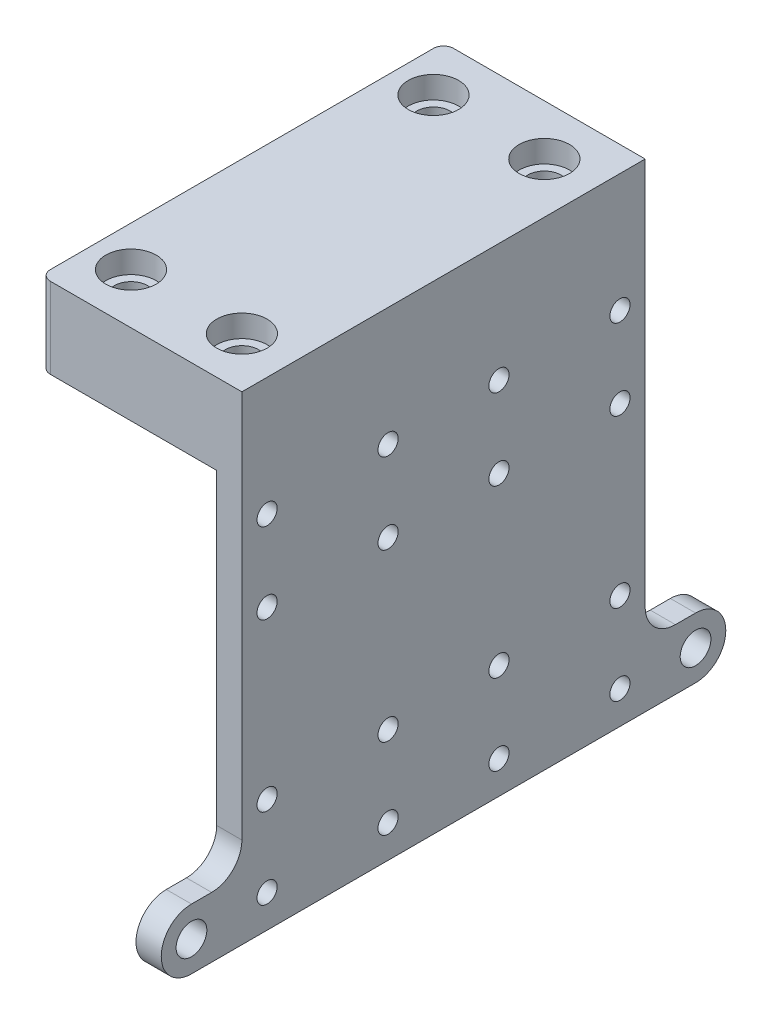
from build123d import *

# Parameters (mm, degrees)
EXTRUDE_1_DEPTH     = 20
RIB_1_REACH         = 57.283
SKETCH_2_WALL_W     = 155.769731092
SKETCH_2_WALL_H     = 4
HOLE_WIZARD_M4_1_D  = 3.3
SKETCH_6_R          = 2.5
CUT_EXTRUDE_1_DEPTH = 2.2
SKETCH_7_R          = 1
CUT_EXTRUDE_2_DEPTH = 10
FILLET_1_R          = 1
SKETCH_8_R          = 1.525
EXTRUDE_2_DEPTH     = 2.5
FILLET_2_R          = 3


with BuildPart() as part:
    # 草图1 → 凸台-拉伸1 (new, symmetric)
    with BuildSketch(Plane.XY):
        Polygon((0, 0), (20, 0), (20, -47.5), (17.5, -47.5), (17.5, -8), (0, -8), align=None)
    extrude(amount=EXTRUDE_1_DEPTH, both=True)

    # 草图2 wall → 筋1 (add, up to next)
    with BuildSketch(Plane(origin=(8.75, -27.75, 0), x_dir=(0.405064377285, -0.914288165872, 0), z_dir=(0.914288165872, 0.405064377285, 0)), mode=Mode.PRIVATE) as rib_1_sk1:
        Rectangle(SKETCH_2_WALL_W, SKETCH_2_WALL_H)
    rib_1_tool1 = extrude(rib_1_sk1.sketch, amount=RIB_1_REACH, mode=Mode.PRIVATE) - part.part
    add(rib_1_tool1.solids().sort_by_distance((8.75, -27.75, 0))[0])

    # M4 螺纹孔1 (through all)
    with Locations(Plane(origin=(0, -8, 0), x_dir=(-1, 0, 0), z_dir=(0, -1, 0))):
        with Locations((-4, 15), (-15, 15)):
            hole_wizard_m4_1 = Hole(HOLE_WIZARD_M4_1_D / 2)

    # 镜向1: M4 螺纹孔1 across plane
    add(hole_wizard_m4_1.mirror(Plane.XY), mode=Mode.SUBTRACT)

    # 草图6 → 切除-拉伸1 (cut)
    with BuildSketch(Plane(origin=(0, 0, 0), x_dir=(1, 0, 0), z_dir=(0, 1, 0))):
        with Locations(Location((15, 15, 0), (0, 0, 270))):
            Circle(SKETCH_6_R)
        with Locations(Location((4, 15, 0), (0, 0, 270))):
            Circle(SKETCH_6_R)
        with Locations(Location((4, -15, 0), (0, 0, 270))):
            Circle(SKETCH_6_R)
        with Locations(Location((15, -15, 0), (0, 0, 270))):
            Circle(SKETCH_6_R)
    extrude(amount=-CUT_EXTRUDE_1_DEPTH, mode=Mode.SUBTRACT)

    # 草图7 → 切除-拉伸2 (cut)
    with BuildSketch(Plane.ZY.offset(-17.5)):
        with Locations(Location((-5.5, -44.25, 0), (0, 0, 270))):
            Circle(SKETCH_7_R)
        with Locations(Location((-17.5, -44.25, 0), (0, 0, 270))):
            Circle(SKETCH_7_R)
        with Locations(Location((-5.5, -36.25, 0), (0, 0, 270))):
            Circle(SKETCH_7_R)
        with Locations(Location((-17.5, -36.25, 0), (0, 0, 270))):
            Circle(SKETCH_7_R)
        with Locations(Location((-5.5, -19.75, 0), (0, 0, 270))):
            Circle(SKETCH_7_R)
        with Locations(Location((-5.5, -11.75, 0), (0, 0, 270))):
            Circle(SKETCH_7_R)
        with Locations(Location((-17.5, -19.75, 0), (0, 0, 270))):
            Circle(SKETCH_7_R)
        with Locations(Location((-17.5, -11.75, 0), (0, 0, 270))):
            Circle(SKETCH_7_R)
        with Locations(Location((17.5, -11.75, 0), (0, 0, 270))):
            Circle(SKETCH_7_R)
        with Locations(Location((17.5, -19.75, 0), (0, 0, 270))):
            Circle(SKETCH_7_R)
        with Locations(Location((5.5, -11.75, 0), (0, 0, 270))):
            Circle(SKETCH_7_R)
        with Locations(Location((5.5, -19.75, 0), (0, 0, 270))):
            Circle(SKETCH_7_R)
        with Locations(Location((17.5, -36.25, 0), (0, 0, 270))):
            Circle(SKETCH_7_R)
        with Locations(Location((5.5, -36.25, 0), (0, 0, 270))):
            Circle(SKETCH_7_R)
        with Locations(Location((17.5, -44.25, 0), (0, 0, 270))):
            Circle(SKETCH_7_R)
        with Locations(Location((5.5, -44.25, 0), (0, 0, 270))):
            Circle(SKETCH_7_R)
    extrude(amount=-CUT_EXTRUDE_2_DEPTH, mode=Mode.SUBTRACT)

    # 圆角1
    fillet_1_edges = [part.edges().sort_by_distance(p)[0] for p in [
        (18.75, -47.5, 20),
        (0, -4, 20),
        (18.75, -47.5, -20),
        (0, -4, -20),
    ]]
    fillet(fillet_1_edges, radius=FILLET_1_R)

    # 草图8 → 凸台-拉伸2 (add)
    with BuildSketch(Plane.ZY.offset(-17.5)):
        with BuildLine():
            Line((19, -47.5), (25, -47.5))
            ThreePointArc((25, -47.5), (28, -44.5), (25, -41.5))
            Line((25, -41.5), (20, -41.5))
            Line((20, -41.5), (19, -47.5))
        make_face()
        with Locations((25, -44.5)):
            Circle(SKETCH_8_R, mode=Mode.SUBTRACT)
    extrude_2 = extrude(amount=-EXTRUDE_2_DEPTH)

    # 镜向2: 凸台-拉伸2 across plane
    add(extrude_2.mirror(Plane.XY))

    # 圆角2
    fillet_2_edges = [part.edges().sort_by_distance(p)[0] for p in [
        (18.75, -41.5, 20),
        (18.75, -41.5, -20),
    ]]
    fillet(fillet_2_edges, radius=FILLET_2_R)


solid = part.part
